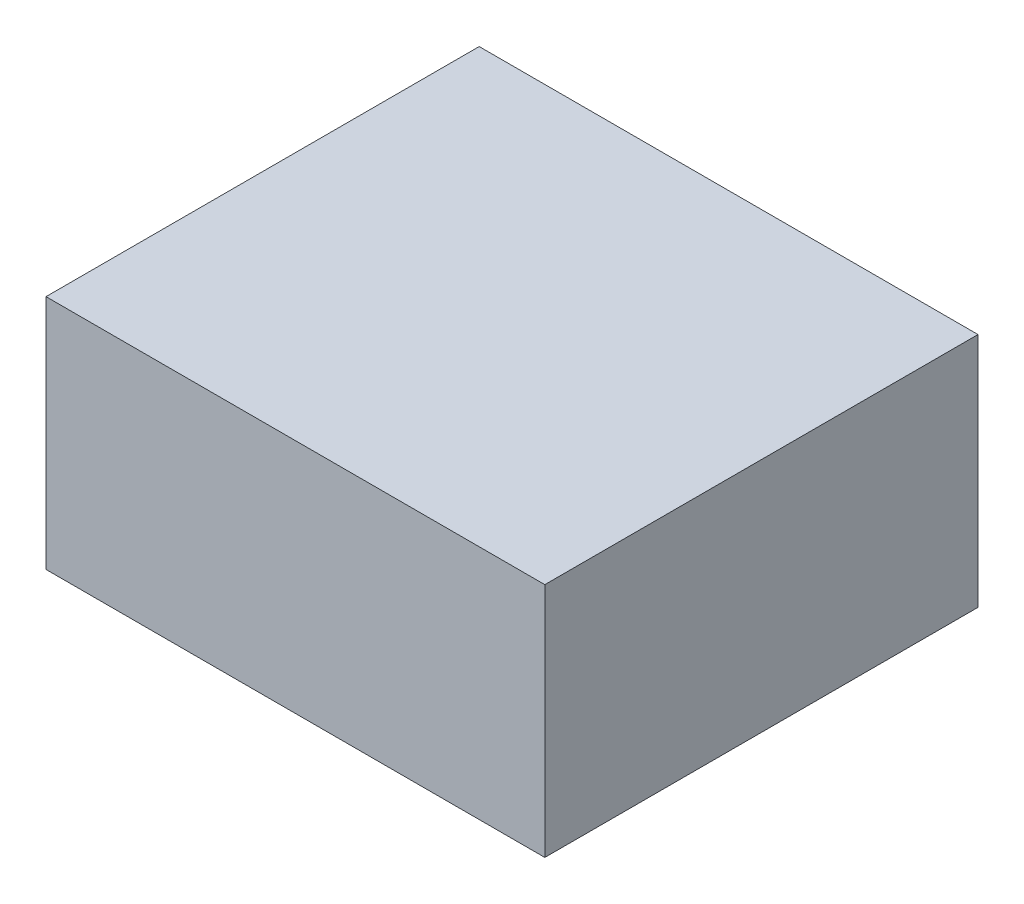
from build123d import *

# Parameters (mm, degrees)
SKETCH_1_W      = 38
SKETCH_1_H      = 33
EXTRUDE_1_DEPTH = 18


with BuildPart() as part:
    # 草图1 → 凸台-拉伸1 (new body)
    with BuildSketch(Plane(origin=(0, 0, 0), x_dir=(1, 0, 0), z_dir=(0, 1, 0))):
        with Locations((19, -16.5)):
            Rectangle(SKETCH_1_W, SKETCH_1_H)
    extrude(amount=EXTRUDE_1_DEPTH)


solid = part.part
